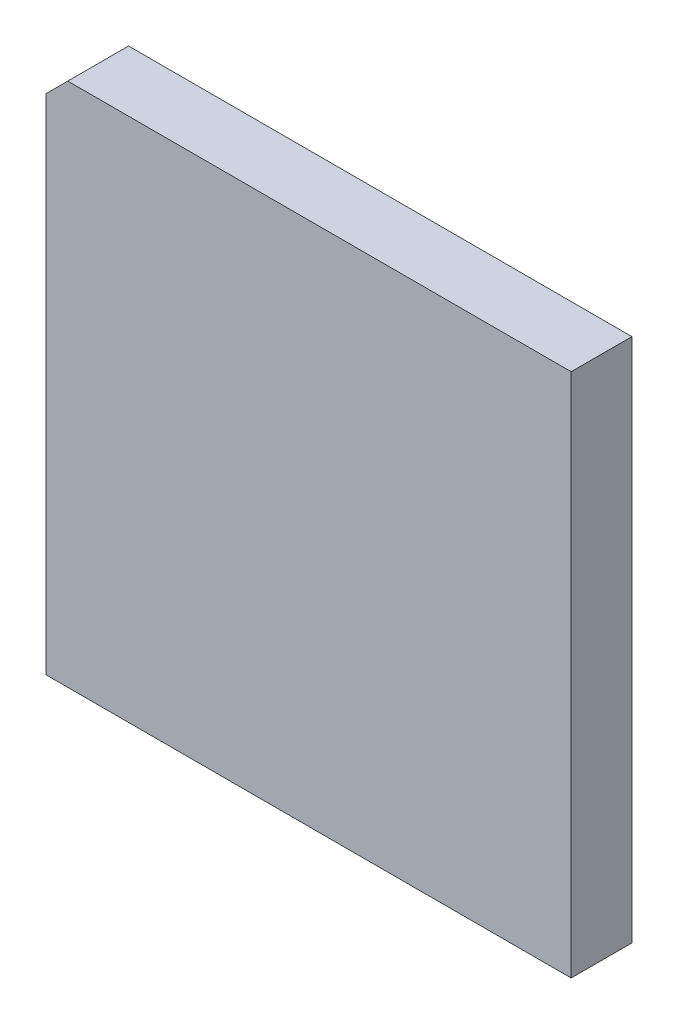
from build123d import *

# Parameters (mm, degrees)
COMPONENT_OUTLINE_DEPTH = 1.4


with BuildPart() as part:
    # 草图1 → Component_Outline (new body)
    with BuildSketch(Plane.XY):
        Polygon((-5.55, 6.05), (-6.05, 5.55), (-6.05, -6.05), (6.05, -6.05), (6.05, 6.05), align=None)
    extrude(amount=COMPONENT_OUTLINE_DEPTH)


solid = part.part
